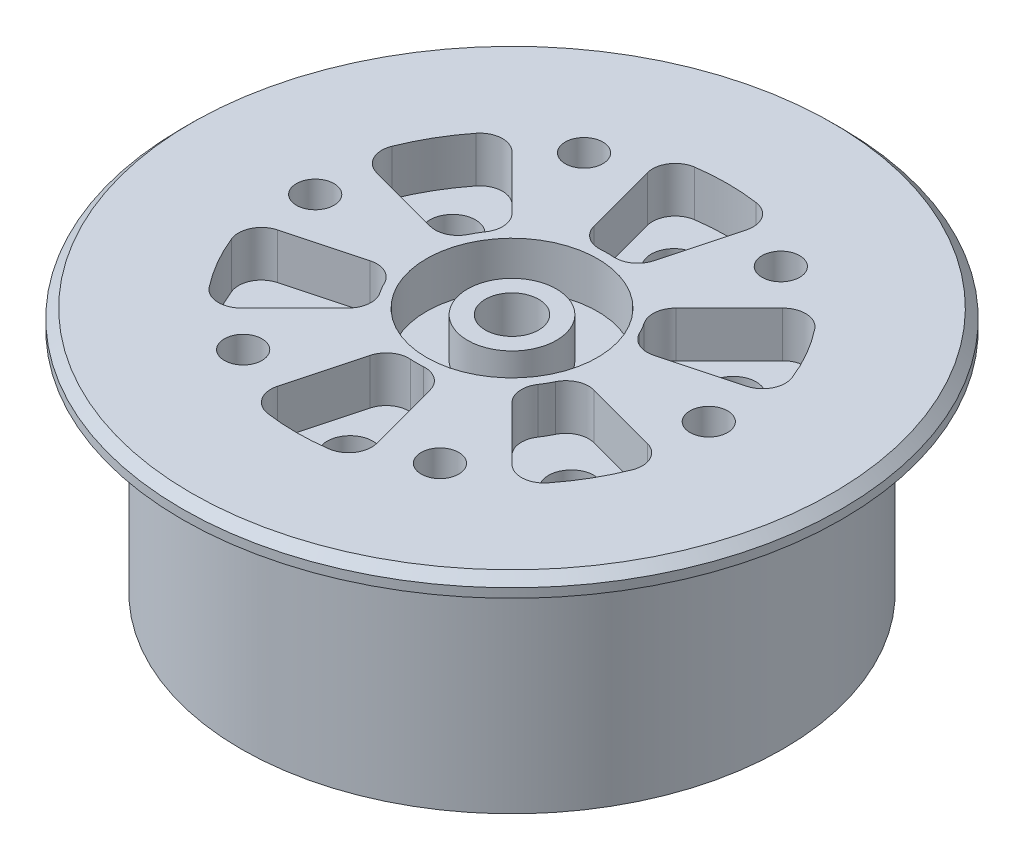
from build123d import *

# Parameters (mm, degrees)
SKETCH_1_R             = 28.9
EXTRUDE_1_DEPTH        = 1.6
CHAMFER_1_SIZE         = 0.8
SKETCH_2_R             = 23.75
EXTRUDE_2_DEPTH        = 20
HOLE_WIZARD_M4_1_D     = 3.3
HOLE_WIZARD_M4_1_DEPTH = 9.008579979
HOLE_WIZARD_M4_1_TIP   = 0.991420021
SKETCH_3_R             = 7.5
CUT_EXTRUDE_1_DEPTH    = 4
SKETCH_7_R             = 3.9
EXTRUDE_3_DEPTH        = 3.5
SKETCH_8_R             = 2.34
CUT_EXTRUDE_2_DEPTH    = 10
SKETCH_9_R             = 2
CUT_EXTRUDE_3_DEPTH    = 10


with BuildPart() as part:
    # 草图1 → 凸台-拉伸1 (new body)
    with BuildSketch(Plane(origin=(0, 0, 0), x_dir=(1, 0, 0), z_dir=(0, 1, 0))):
        with Locations(Location((0, 0, 0), (0, 0, 270))):
            Circle(SKETCH_1_R)
    extrude(amount=EXTRUDE_1_DEPTH)

    # 倒角1
    chamfer_1_edges = [part.edges().sort_by_distance(p)[0] for p in [
        (0, 1.6, -28.9),
    ]]
    chamfer(chamfer_1_edges, length=CHAMFER_1_SIZE)

    # 草图2 → 凸台-拉伸2 (add)
    with BuildSketch(Plane.XZ):
        with Locations(Location((0, 0, 0), (0, 0, 270))):
            Circle(SKETCH_2_R)
    extrude(amount=EXTRUDE_2_DEPTH)

    # M4 螺纹孔的螺纹孔钻头1
    with Locations(Plane(origin=(0, 1.6, 0), x_dir=(1, 0, 0), z_dir=(0, 1, 0))):
        with Locations((-17.25, 0), (-8.625, 14.938938215), (8.625, 14.938938215), (17.25, 0), (8.625, -14.938938215), (-8.625, -14.938938215)):
            Hole(HOLE_WIZARD_M4_1_D / 2, depth=HOLE_WIZARD_M4_1_DEPTH)
            with Locations((0, 0, -(HOLE_WIZARD_M4_1_DEPTH + HOLE_WIZARD_M4_1_TIP / 2))):  # 118° drill point
                Cone(0, HOLE_WIZARD_M4_1_D / 2, HOLE_WIZARD_M4_1_TIP, mode=Mode.SUBTRACT)

    # 草图3 → 切除-拉伸1 (cut)
    with BuildSketch(Plane(origin=(0, 1.6, 0), x_dir=(1, 0, 0), z_dir=(0, 1, 0))):
        with Locations(Location((0, 0, 0), (0, 0, 270))):
            Circle(SKETCH_3_R)
        with BuildLine():
            Line((-2.628287969, 9.808904238), (-4.34330439, 16.209432654))
            ThreePointArc((-4.34330439, 16.209432654), (-4.081182154, 17.827981129), (-2.696831759, 18.706605744))
            ThreePointArc((-2.696831759, 18.706605744), (0, 18.9), (2.696831759, 18.706605744))
            ThreePointArc((2.696831759, 18.706605744), (4.081182154, 17.827981129), (4.34330439, 16.209432654))
            Line((4.34330439, 16.209432654), (2.628287969, 9.808904238))
            ThreePointArc((2.628287969, 9.808904238), (1.859855262, 8.699749054), (0.561859251, 8.331075212))
            ThreePointArc((0.561859251, 8.331075212), (0, 8.35), (-0.561859251, 8.331075212))
            ThreePointArc((-0.561859251, 8.331075212), (-1.859855262, 8.699749054), (-2.628287969, 9.808904238))
        make_face()
        with BuildLine():
            Line((9.808904238, 2.628287969), (16.209432654, 4.34330439))
            ThreePointArc((16.209432654, 4.34330439), (17.480075633, 5.379583142), (17.548811672, 7.017778059))
            ThreePointArc((17.548811672, 7.017778059), (16.367880132, 9.45), (14.851979913, 11.688827685))
            ThreePointArc((14.851979913, 11.688827685), (13.398893479, 12.448397987), (11.866128265, 11.866128265))
            Line((11.866128265, 11.866128265), (7.180616269, 7.180616269))
            ThreePointArc((7.180616269, 7.180616269), (6.604276056, 5.960556431), (6.933993149, 4.65212199))
            ThreePointArc((6.933993149, 4.65212199), (7.231312122, 4.175), (7.495852399, 3.678953221))
            ThreePointArc((7.495852399, 3.678953221), (8.464131318, 2.739192623), (9.808904238, 2.628287969))
        make_face()
        with BuildLine():
            Line((7.180616269, -7.180616269), (11.866128265, -11.866128265))
            ThreePointArc((11.866128265, -11.866128265), (13.398893479, -12.448397987), (14.851979913, -11.688827685))
            ThreePointArc((14.851979913, -11.688827685), (16.367880132, -9.45), (17.548811672, -7.017778059))
            ThreePointArc((17.548811672, -7.017778059), (17.480075633, -5.379583142), (16.209432654, -4.34330439))
            Line((16.209432654, -4.34330439), (9.808904238, -2.628287969))
            ThreePointArc((9.808904238, -2.628287969), (8.464131318, -2.739192623), (7.495852399, -3.678953221))
            ThreePointArc((7.495852399, -3.678953221), (7.231312122, -4.175), (6.933993149, -4.65212199))
            ThreePointArc((6.933993149, -4.65212199), (6.604276056, -5.960556431), (7.180616269, -7.180616269))
        make_face()
        with BuildLine():
            Line((-2.628287969, -9.808904238), (-4.34330439, -16.209432654))
            ThreePointArc((-4.34330439, -16.209432654), (-4.081182154, -17.827981129), (-2.696831759, -18.706605744))
            ThreePointArc((-2.696831759, -18.706605744), (0, -18.9), (2.696831759, -18.706605744))
            ThreePointArc((2.696831759, -18.706605744), (4.081182154, -17.827981129), (4.34330439, -16.209432654))
            Line((4.34330439, -16.209432654), (2.628287969, -9.808904238))
            ThreePointArc((2.628287969, -9.808904238), (1.859855262, -8.699749054), (0.561859251, -8.331075212))
            ThreePointArc((0.561859251, -8.331075212), (0, -8.35), (-0.561859251, -8.331075212))
            ThreePointArc((-0.561859251, -8.331075212), (-1.859855262, -8.699749054), (-2.628287969, -9.808904238))
        make_face()
        with BuildLine():
            Line((-9.808904238, -2.628287969), (-16.209432654, -4.34330439))
            ThreePointArc((-16.209432654, -4.34330439), (-17.480075633, -5.379583142), (-17.548811672, -7.017778059))
            ThreePointArc((-17.548811672, -7.017778059), (-16.367880132, -9.45), (-14.851979913, -11.688827685))
            ThreePointArc((-14.851979913, -11.688827685), (-13.398893479, -12.448397987), (-11.866128265, -11.866128265))
            Line((-11.866128265, -11.866128265), (-7.180616269, -7.180616269))
            ThreePointArc((-7.180616269, -7.180616269), (-6.604276056, -5.960556431), (-6.933993149, -4.65212199))
            ThreePointArc((-6.933993149, -4.65212199), (-7.231312122, -4.175), (-7.495852399, -3.678953221))
            ThreePointArc((-7.495852399, -3.678953221), (-8.464131318, -2.739192623), (-9.808904238, -2.628287969))
        make_face()
        with BuildLine():
            Line((-7.180616269, 7.180616269), (-11.866128265, 11.866128265))
            ThreePointArc((-11.866128265, 11.866128265), (-13.398893479, 12.448397987), (-14.851979913, 11.688827685))
            ThreePointArc((-14.851979913, 11.688827685), (-16.367880132, 9.45), (-17.548811672, 7.017778059))
            ThreePointArc((-17.548811672, 7.017778059), (-17.480075633, 5.379583142), (-16.209432654, 4.34330439))
            Line((-16.209432654, 4.34330439), (-9.808904238, 2.628287969))
            ThreePointArc((-9.808904238, 2.628287969), (-8.464131318, 2.739192623), (-7.495852399, 3.678953221))
            ThreePointArc((-7.495852399, 3.678953221), (-7.231312122, 4.175), (-6.933993149, 4.65212199))
            ThreePointArc((-6.933993149, 4.65212199), (-6.604276056, 5.960556431), (-7.180616269, 7.180616269))
        make_face()
    extrude(amount=-CUT_EXTRUDE_1_DEPTH, mode=Mode.SUBTRACT)

    # 草图7 → 凸台-拉伸3 (add)
    with BuildSketch(Plane(origin=(0, -2.4, 0), x_dir=(1, 0, 0), z_dir=(0, 1, 0))):
        with Locations(Location((0, 0, 0), (0, 0, 270))):
            Circle(SKETCH_7_R)
    extrude(amount=EXTRUDE_3_DEPTH)

    # 草图8 → 切除-拉伸2 (cut)
    with BuildSketch(Plane(origin=(0, 1.1, 0), x_dir=(1, 0, 0), z_dir=(0, 1, 0))):
        with Locations(Location((0, 0, 0), (0, 0, 270))):
            Circle(SKETCH_8_R)
    extrude(amount=-CUT_EXTRUDE_2_DEPTH, mode=Mode.SUBTRACT)

    # 草图9 → 切除-拉伸3 (cut)
    with BuildSketch(Plane(origin=(0, -2.4, 0), x_dir=(1, 0, 0), z_dir=(0, 1, 0))):
        with Locations(Location((-12.297560734, 7.1, 0), (0, 0, 270))):
            Circle(SKETCH_9_R)
        with Locations(Location((0, 14.2, 0), (0, 0, 270))):
            Circle(SKETCH_9_R)
        with Locations(Location((12.297560734, 7.1, 0), (0, 0, 270))):
            Circle(SKETCH_9_R)
        with Locations(Location((12.297560734, -7.1, 0), (0, 0, 270))):
            Circle(SKETCH_9_R)
        with Locations(Location((0, -14.2, 0), (0, 0, 270))):
            Circle(SKETCH_9_R)
        with Locations(Location((-12.297560734, -7.1, 0), (0, 0, 270))):
            Circle(SKETCH_9_R)
    extrude(amount=-CUT_EXTRUDE_3_DEPTH, mode=Mode.SUBTRACT)


solid = part.part
